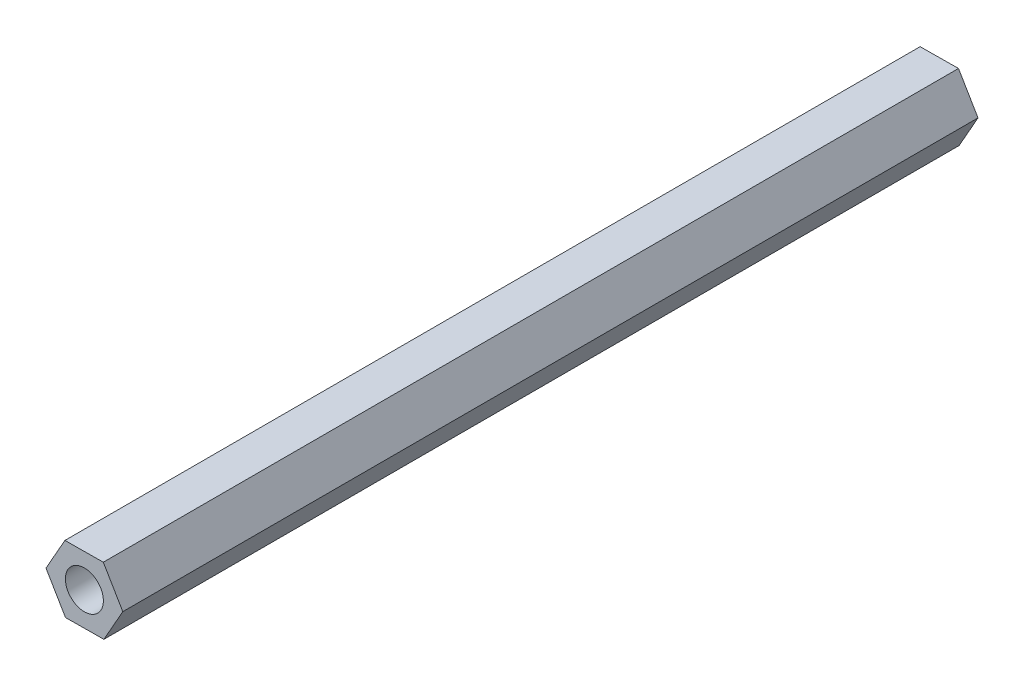
from build123d import *

# Parameters (mm, degrees)
SKETCH_1_R      = 2
EXTRUDE_1_DEPTH = 90


with BuildPart() as part:
    # 草图1 → 凸台-拉伸1 (new body)
    with BuildSketch(Plane.XY):
        Polygon((2.051456248, -3.482077052), (4.041295309, 0.035574699), (1.989839061, 3.517651751), (-2.051456248, 3.482077052), (-4.041295309, -0.035574699), (-1.989839061, -3.517651751), align=None)
        with Locations(Location((0, 0, 0), (0, 0, 180))):
            Circle(SKETCH_1_R, mode=Mode.SUBTRACT)
    extrude(amount=EXTRUDE_1_DEPTH)


solid = part.part
